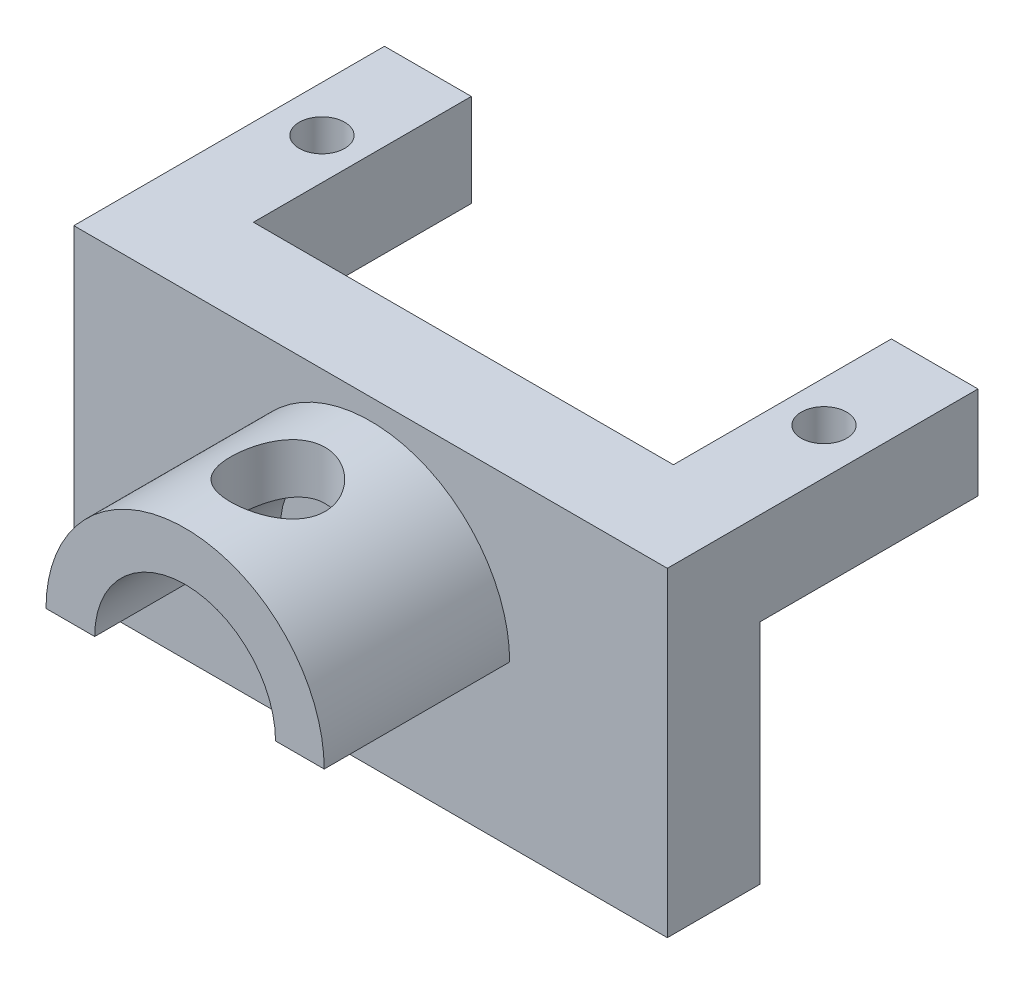
from build123d import *

# Parameters (mm, degrees)
SKETCH1_W                   = 32.512
SKETCH1_H                   = 17.526
BOSS_EXTRUDE1_DEPTH         = 5.08
SKETCH2_W                   = 4.758
SKETCH2_H                   = 5.08
SKETCH2_W_2                 = 4.746
BOSS_EXTRUDE2_DEPTH         = 11.938
F_40_0_098_DIAMETER_HOLE1_D = 2.4892
BOSS_EXTRUDE3_DEPTH         = 10.16
F_6_0_204_DIAMETER_HOLE2_D  = 5.1816


with BuildPart() as part:
    # Sketch1 → Boss-Extrude1 (new body)
    with BuildSketch(Plane.XY):
        Rectangle(SKETCH1_W, SKETCH1_H)
    extrude(amount=BOSS_EXTRUDE1_DEPTH)

    # Sketch2 → Boss-Extrude2 (add)
    with BuildSketch(Plane(origin=(0, 0, 0), x_dir=(-1, 0, 0), z_dir=(0, 0, -1))):
        with Locations((13.877, 6.223)):
            Rectangle(SKETCH2_W, SKETCH2_H)
        with Locations((-13.883, 6.223)):
            Rectangle(SKETCH2_W_2, SKETCH2_H)
    extrude(amount=BOSS_EXTRUDE2_DEPTH)

    # #40 (0.098) Diameter Hole1 (through all)
    with Locations(Plane(origin=(0, 8.763, 0), x_dir=(1, 0, 0), z_dir=(0, 1, 0))):
        with Locations((-13.744, 6), (13.756, 6)):
            Hole(F_40_0_098_DIAMETER_HOLE1_D / 2)

    # Sketch5 → Boss-Extrude3 (add)
    with BuildSketch(Plane.XY.offset(5.08)):
        with BuildLine():
            Line((7.62, 0), (4.953, 0))
            ThreePointArc((4.953, 0), (0, 4.953), (-4.953, 0))
            Line((-4.953, 0), (-7.62, 0))
            ThreePointArc((-7.62, 0), (0, 7.62), (7.62, 0))
        make_face()
    extrude(amount=BOSS_EXTRUDE3_DEPTH)

    # #6 (0.204) Diameter Hole2 (through all)
    with Locations(Plane(origin=(0, 7.62, 0), x_dir=(1, 0, 0), z_dir=(0, 1, 0))):
        with Locations((0, -10.16)):
            Hole(F_6_0_204_DIAMETER_HOLE2_D / 2)


solid = part.part
